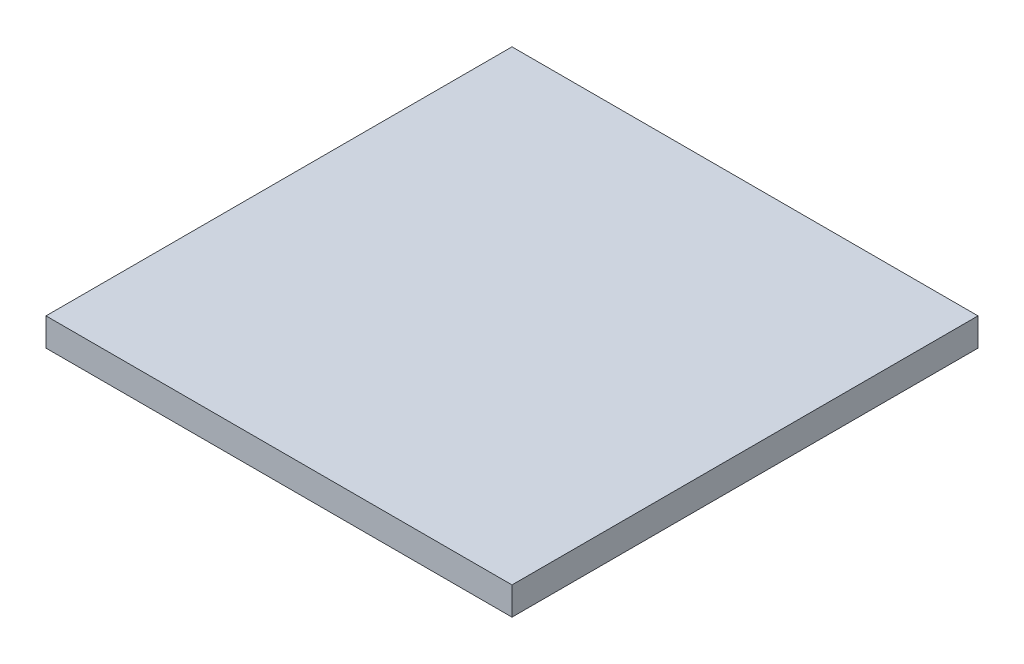
from build123d import *

# Parameters (mm, degrees)
SKETCH1_W           = 50
SKETCH1_H           = 50
BOSS_EXTRUDE1_DEPTH = 3


with BuildPart() as part:
    # Sketch1 → Boss-Extrude1 (new body)
    with BuildSketch(Plane(origin=(0, 0, 0), x_dir=(1, 0, 0), z_dir=(0, 1, 0))):
        with Locations((-25, 25)):
            Rectangle(SKETCH1_W, SKETCH1_H)
    extrude(amount=BOSS_EXTRUDE1_DEPTH)


solid = part.part
